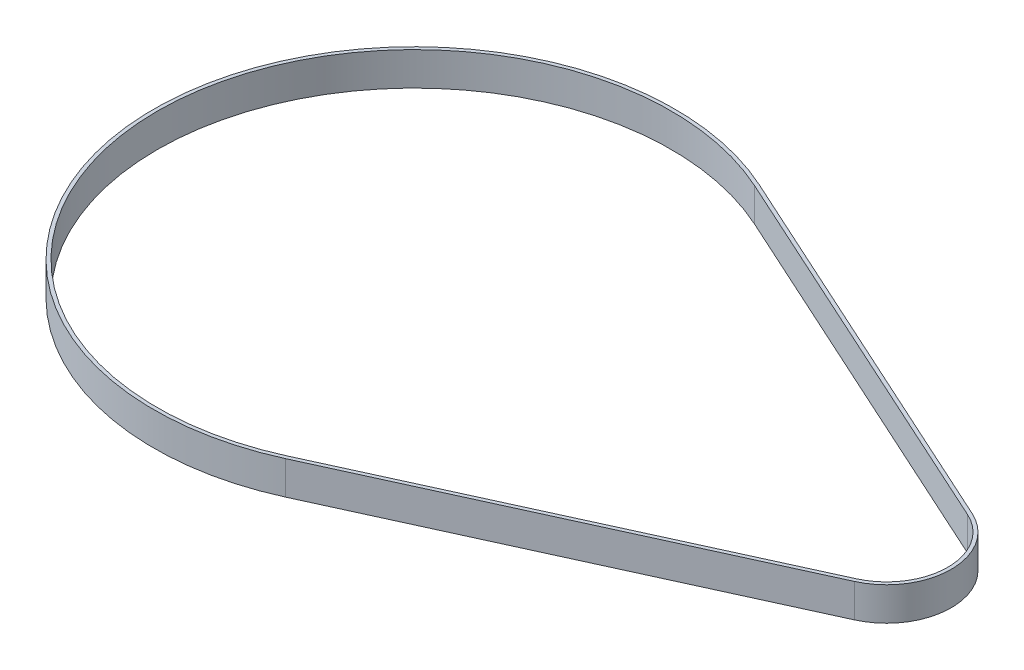
from build123d import *

# Parameters (mm, degrees)
BOSS_EXTRUDE1_DEPTH = 3


with BuildPart() as part:
    # Sketch1 → Boss-Extrude1 (new, symmetric)
    with BuildSketch(Plane(origin=(0, 0, 0), x_dir=(1, 0, 0), z_dir=(0, 1, 0))):
        with BuildLine():
            Line((19.441411765, -42.658714334), (89.823029412, -10.582782587))
            ThreePointArc((89.823029412, -10.582782587), (96.63, 0), (89.823029412, 10.582782587))
            Line((89.823029412, 10.582782587), (19.441411765, 42.658714334))
            ThreePointArc((19.441411765, 42.658714334), (-46.88, 0), (19.441411765, -42.658714334))
        make_face()
        with BuildLine():
            Line((89.561764706, 10.009510616), (19.180147059, 42.085442362))
            ThreePointArc((19.180147059, 42.085442362), (-46.25, 0), (19.180147059, -42.085442362))
            Line((19.180147059, -42.085442362), (89.561764706, -10.009510616))
            ThreePointArc((89.561764706, -10.009510616), (96, 0), (89.561764706, 10.009510616))
        make_face(mode=Mode.SUBTRACT)
    extrude(amount=BOSS_EXTRUDE1_DEPTH, both=True)


solid = part.part
